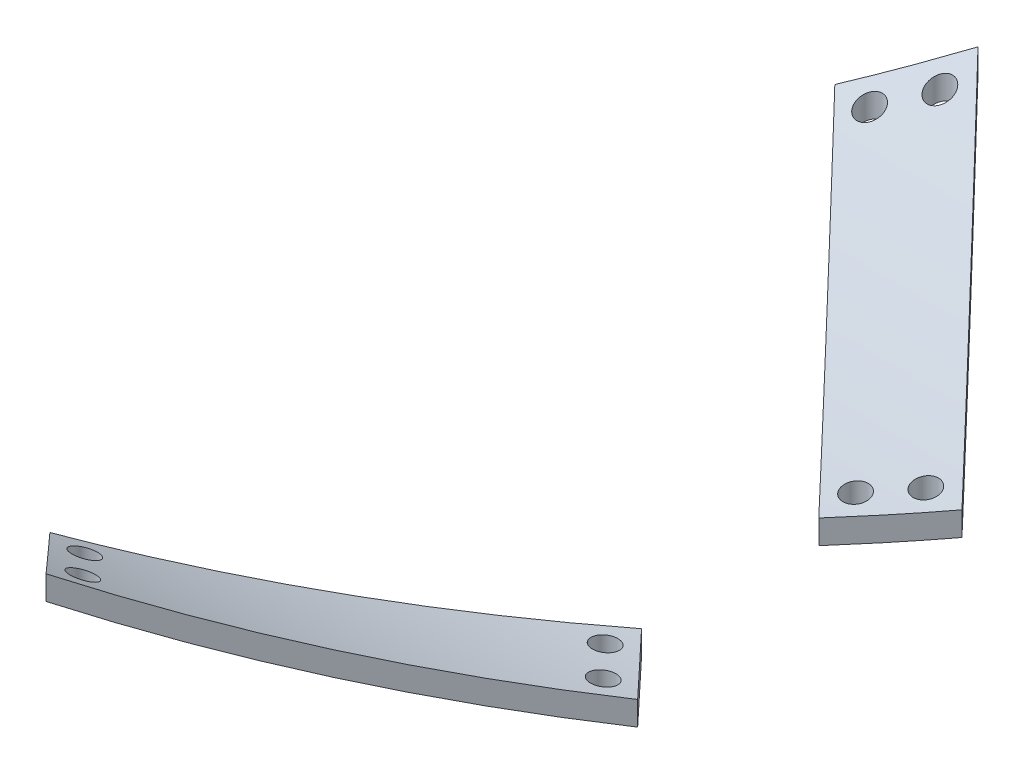
from build123d import *

# Parameters (mm, degrees)
BOSS_EXTRUDE4_DEPTH = 304.8
SKETCH5_OUTSIDE_W   = 384.928
SKETCH5_OUTSIDE_H   = 321.428
CUT_EXTRUDE1_DEPTH  = 304.8
SKETCH6_R           = 3.175
CUT_EXTRUDE2_DEPTH  = 304.8


with BuildPart() as part:
    # Sketch3 → Boss-Extrude4 (new body)
    with BuildSketch(Plane(origin=(0, 0, 0), x_dir=(0, 0, -1), z_dir=(1, 0, 0))):
        with BuildLine():
            ThreePointArc((232.90669496, 1.961354585), (112.25669496, -30.366715482), (-8.39330504, 1.961354585))
            Line((-8.39330504, 1.961354585), (-8.39330504, -4.052041589))
            ThreePointArc((-8.39330504, -4.052041589), (112.25669496, -36.380111656), (232.90669496, -4.052041589))
            Line((232.90669496, -4.052041589), (232.90669496, 1.961354585))
        make_face()
    extrude(amount=BOSS_EXTRUDE4_DEPTH)

    # Sketch5 outside → Cut-Extrude1 (cut)
    with BuildSketch(Plane(origin=(0, 1.961354585, 0), x_dir=(1, 0, 0), z_dir=(0, 1, 0))):
        with Locations((152.4, 112.257)):
            Rectangle(SKETCH5_OUTSIDE_W, SKETCH5_OUTSIDE_H)
        Polygon((226.828288051, 228.148595599), (299.003543902, 151.948595599), (280.562627926, 134.48169496), (208.387372074, 210.68169496), align=None, mode=Mode.SUBTRACT)
        Polygon((282.575, 88.019322885), (300.04190064, 69.578406909), (223.84190064, -2.596848943), (206.375, 15.844067034), align=None, mode=Mode.SUBTRACT)
    extrude(amount=-CUT_EXTRUDE1_DEPTH, mode=Mode.SUBTRACT)


with BuildPart() as cut_extrude1_piece_1:
    # of the separate pieces the step leaves, piece 1, a body of its own (cut_extrude1_pieces)
    add(part.part.solids().sort_by_distance((206.375, -10.268648513, -15.844067034))[0])


with BuildPart() as cut_extrude1_piece_2:
    # of the separate pieces the step leaves, piece 2, a body of its own (cut_extrude1_pieces)
    add(part.part.solids().sort_by_distance((208.387372074, -9.380603776, -210.68169496))[0])


with BuildPart() as cut_extrude2_tool:
    # Sketch6 → Cut-Extrude2 (new body)
    with BuildSketch(Plane(origin=(0, 1.961354585, 0), x_dir=(1, 0, 0), z_dir=(0, 1, 0))):
        with Locations(Location((224.085404474, 6.380105211, 0), (0, 0, 270))):
            Circle(SKETCH6_R)
        with Locations(Location((215.351954154, 15.6005632, 0), (0, 0, 270))):
            Circle(SKETCH6_R)
        with Locations(Location((282.377616466, 79.086053042, 0), (0, 0, 270))):
            Circle(SKETCH6_R)
        with Locations(Location((291.111066785, 69.865595053, 0), (0, 0, 270))):
            Circle(SKETCH6_R)
        with Locations(Location((280.686030826, 143.582052014, 0), (0, 0, 270))):
            Circle(SKETCH6_R)
        with Locations(Location((289.736735323, 152.15471491, 0), (0, 0, 270))):
            Circle(SKETCH6_R)
        with Locations(Location((226.531741371, 218.884239902, 0), (0, 0, 270))):
            Circle(SKETCH6_R)
        with Locations(Location((217.481036874, 210.311577006, 0), (0, 0, 270))):
            Circle(SKETCH6_R)
    extrude(amount=-CUT_EXTRUDE2_DEPTH)


with BuildPart() as cut_extrude1_piece_1_1:
    add(cut_extrude1_piece_1.part)

    # Cut-Extrude2: cut by cut_extrude2_tool
    add(cut_extrude2_tool.part, mode=Mode.SUBTRACT)


with BuildPart() as cut_extrude1_piece_2_1:
    add(cut_extrude1_piece_2.part)

    # Cut-Extrude2: cut by cut_extrude2_tool
    add(cut_extrude2_tool.part, mode=Mode.SUBTRACT)


solid = Compound([cut_extrude1_piece_1_1.part, cut_extrude1_piece_2_1.part])
